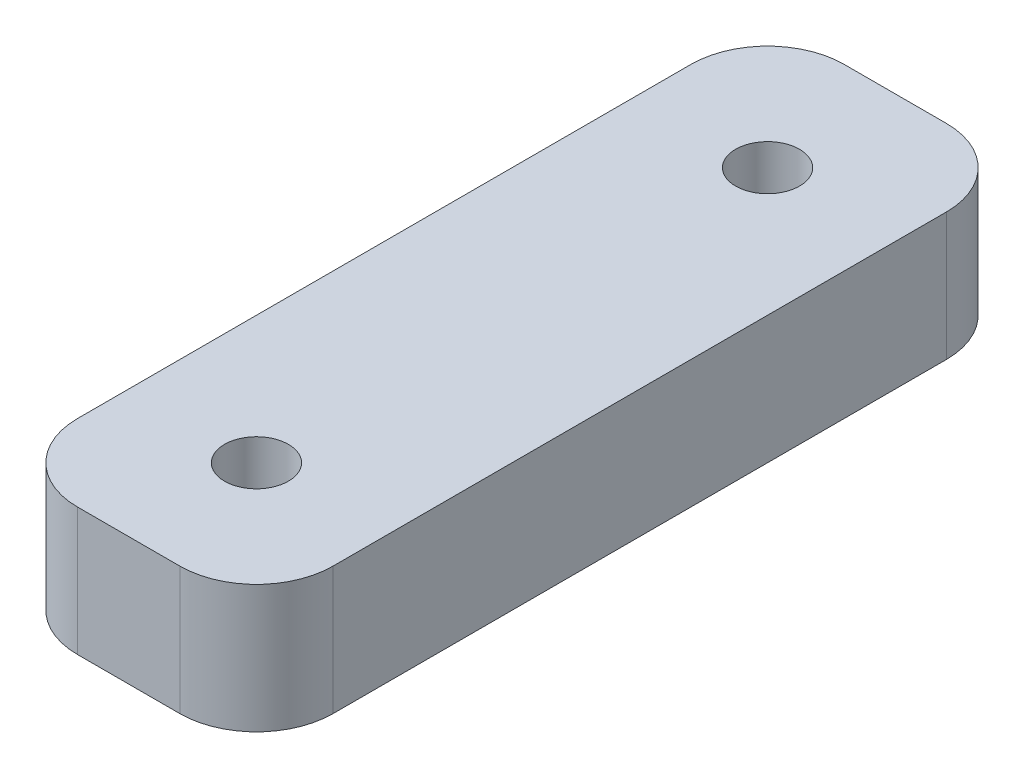
from build123d import *

# Parameters (mm, degrees)
SKETCH1_W           = 10
SKETCH1_H           = 30
SKETCH1_R           = 1.25
BOSS_EXTRUDE1_DEPTH = 5
FILLET1_R           = 3


with BuildPart() as part:
    # Sketch1 → Boss-Extrude1 (new body)
    with BuildSketch(Plane(origin=(0, 0, 0), x_dir=(1, 0, 0), z_dir=(0, 1, 0))):
        with Locations((8, 15)):
            Rectangle(SKETCH1_W, SKETCH1_H)
        with Locations(Location((8, 25, 0), (0, 0, 270))):
            Circle(SKETCH1_R, mode=Mode.SUBTRACT)
        with Locations(Location((8, 5, 0), (0, 0, 270))):
            Circle(SKETCH1_R, mode=Mode.SUBTRACT)
    extrude(amount=BOSS_EXTRUDE1_DEPTH)

    # Fillet1
    fillet1_edges = [part.edges().sort_by_distance(p)[0] for p in [
        (3, 2.5, -30),
        (13, 2.5, -30),
        (13, 2.5, 0),
        (3, 2.5, 0),
    ]]
    fillet(fillet1_edges, radius=FILLET1_R)


solid = part.part
